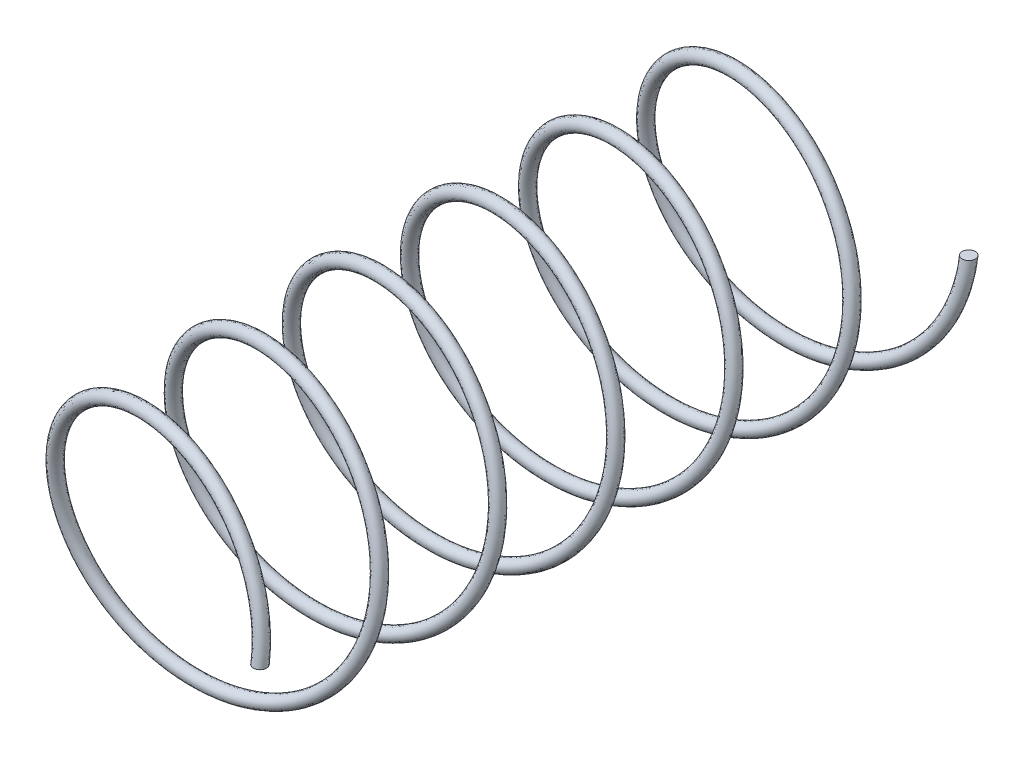
from build123d import *

# Parameters (mm, degrees)
SWEEP_2_PITCH  = 4.5
SWEEP_2_HEIGHT = 27
SWEEP_2_RADIUS = 5
SKETCH_11_R    = 0.25


with BuildPart() as part:
    # 扫描2: sweep along a helix
    with BuildLine() as sweep_2_path:
        Helix(SWEEP_2_PITCH, SWEEP_2_HEIGHT, SWEEP_2_RADIUS, center=(0, 0, 0), direction=(0, 0, 1), lefthand=True)
    # 草图11 → 扫描2 (sweep)
    with BuildSketch(Plane(origin=(0, 0, 0), x_dir=(1, 0, 0), z_dir=(0, 1, 0))):
        with Locations((5, -27)):
            Circle(SKETCH_11_R)
    sweep(path=sweep_2_path.line, is_frenet=True)


solid = part.part
